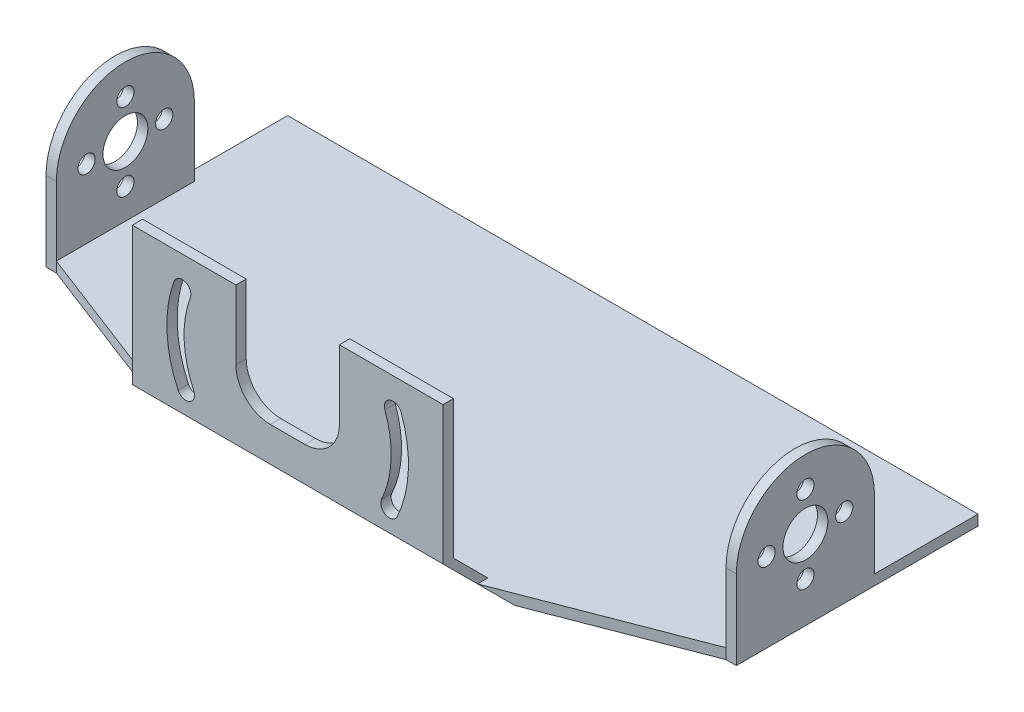
from build123d import *

# Parameters (mm, degrees)
SKETCH1_W                = 200
SKETCH1_H                = 100
BOSS_EXTRUDE1_DEPTH      = 3
BOSS_EXTRUDE2_DEPTH      = 50
CUT_EXTRUDE1_DEPTH       = 50
CUT_EXTRUDE2_DEPTH       = 152.026487743
CUT_EXTRUDE2_DEPTH_BACK  = 152.026487743
BOSS_EXTRUDE4_DEPTH      = 30
SKETCH7_R                = 6.5
CUT_EXTRUDE4_DEPTH       = 220
SKETCH8_W                = 3
SKETCH8_H                = 40
BOSS_EXTRUDE5_DEPTH      = 10
SKETCH9_R                = 2.5
CUT_EXTRUDE5_DEPTH       = 247
CUT_EXTRUDE6_DEPTH       = 29
CUT_EXTRUDE7_DEPTH       = 29
SKETCH12_W               = 90
SKETCH12_H               = 10
CUT_EXTRUDE9_DEPTH       = 3
BOSS_EXTRUDE6_DEPTH      = 90
CUT_EXTRUDE10_DEPTH      = 90
CUT_EXTRUDE11_DEPTH      = 90
CUT_EXTRUDE12_DEPTH      = 217.5
CUT_EXTRUDE14_DEPTH      = 59
CUT_EXTRUDE14_DEPTH_BACK = 122


with BuildPart() as part:
    # Sketch1 → Boss-Extrude1 (new body)
    with BuildSketch(Plane(origin=(0, 0, 0), x_dir=(1, 0, 0), z_dir=(0, 1, 0))):
        Rectangle(SKETCH1_W, SKETCH1_H)
    extrude(amount=BOSS_EXTRUDE1_DEPTH)

    # Sketch2 → Boss-Extrude2 (add)
    with BuildSketch(Plane(origin=(0, 3, 0), x_dir=(1, 0, 0), z_dir=(0, 1, 0))):
        Polygon((0, -50), (-45, -50), (-45, -47), (45, -47), (45, -50), align=None)
    extrude(amount=BOSS_EXTRUDE2_DEPTH)

    # Sketch3 → Cut-Extrude1 (cut)
    with BuildSketch(Plane.XY.offset(50)):
        with BuildLine():
            ThreePointArc((-32.889241728, 44.970705016), (-34.967685824, 31.496355047), (-31.740232125, 18.250163911))
            ThreePointArc((-31.740232125, 18.250163911), (-28.419512967, 17.036564194), (-27.20591325, 20.357283352))
            ThreePointArc((-27.20591325, 20.357283352), (-29.972302134, 31.711161468), (-28.190778624, 43.2606043))
            ThreePointArc((-28.190778624, 43.2606043), (-29.684959817, 46.46488621), (-32.889241728, 44.970705016))
        make_face()
        with BuildLine():
            ThreePointArc((27.20591325, 20.357283352), (28.419512967, 17.036564194), (31.740232125, 18.250163911))
            ThreePointArc((31.740232125, 18.250163911), (34.967685824, 31.496355047), (32.889241728, 44.970705016))
            ThreePointArc((32.889241728, 44.970705016), (29.684959817, 46.46488621), (28.190778624, 43.2606043))
            ThreePointArc((28.190778624, 43.2606043), (29.972302134, 31.711161468), (27.20591325, 20.357283352))
        make_face()
    extrude(amount=-CUT_EXTRUDE1_DEPTH, mode=Mode.SUBTRACT)

    # Sketch4 → Cut-Extrude2 (cut, two sides: drawn at the far end of the back side and taken through both)
    with BuildSketch(Plane.XY.offset(50).offset(-CUT_EXTRUDE2_DEPTH_BACK)):
        with BuildLine():
            Line((15, 33), (15, 53))
            Line((15, 53), (-15, 53))
            Line((-15, 53), (-15, 33))
            ThreePointArc((-15, 33), (-12.071067812, 25.928932188), (-5, 23))
            Line((-5, 23), (5, 23))
            ThreePointArc((5, 23), (12.071067812, 25.928932188), (15, 33))
        make_face()
    extrude(amount=CUT_EXTRUDE2_DEPTH + CUT_EXTRUDE2_DEPTH_BACK, mode=Mode.SUBTRACT)

    # Sketch5 → Boss-Extrude4 (add)
    with BuildSketch(Plane(origin=(0, 3, 0), x_dir=(1, 0, 0), z_dir=(0, 1, 0))):
        Polygon((-100, 0), (-100, 20), (-97, 20), (-97, -20), (-100, -20), align=None)
        Polygon((100, 0), (100, 20), (97, 20), (97, -20), (100, -20), align=None)
    extrude(amount=BOSS_EXTRUDE4_DEPTH)

    # Sketch7 → Cut-Extrude4 (cut)
    with BuildSketch(Plane.ZY.offset(100)):
        with Locations((0, 23)):
            Circle(SKETCH7_R)
    extrude(amount=-CUT_EXTRUDE4_DEPTH, mode=Mode.SUBTRACT)

    # Sketch8 → Boss-Extrude5 (add)
    with BuildSketch(Plane(origin=(0, 33, 0), x_dir=(1, 0, 0), z_dir=(0, 1, 0))):
        with Locations((-98.5, 0)):
            Rectangle(SKETCH8_W, SKETCH8_H)
        with Locations((98.5, 0)):
            Rectangle(SKETCH8_W, SKETCH8_H)
    extrude(amount=BOSS_EXTRUDE5_DEPTH)

    # Sketch9 → Cut-Extrude5 (cut)
    with BuildSketch(Plane.ZY.offset(100)):
        with Locations((0, 34.25)):
            Circle(SKETCH9_R)
        with Locations((-11.25, 23)):
            Circle(SKETCH9_R)
        with Locations((0, 11.75)):
            Circle(SKETCH9_R)
        with Locations((11.25, 23)):
            Circle(SKETCH9_R)
    extrude(amount=-CUT_EXTRUDE5_DEPTH, mode=Mode.SUBTRACT)

    # Sketch10 → Cut-Extrude6 (cut)
    with BuildSketch(Plane(origin=(0, 3, 0), x_dir=(1, 0, 0), z_dir=(0, 1, 0))):
        Polygon((-45, -50), (-100, -20), (-100, -50), align=None)
    extrude(amount=-CUT_EXTRUDE6_DEPTH, mode=Mode.SUBTRACT)

    # Sketch11 → Cut-Extrude7 (cut)
    with BuildSketch(Plane(origin=(0, 3, 0), x_dir=(1, 0, 0), z_dir=(0, 1, 0))):
        Polygon((45, -50), (100, -20), (100, -50), align=None)
    extrude(amount=-CUT_EXTRUDE7_DEPTH, mode=Mode.SUBTRACT)

    # Sketch12 → Cut-Extrude9 (cut)
    with BuildSketch(Plane.XY.offset(50)):
        with Locations((0, 8)):
            Rectangle(SKETCH12_W, SKETCH12_H)
    extrude(amount=-CUT_EXTRUDE9_DEPTH, mode=Mode.SUBTRACT)


with BuildPart() as cut_extrude9_piece_1:
    # of the separate pieces the step leaves, piece 1, a body of its own (cut_extrude9_pieces)
    add(part.part.solids().sort_by_distance((100, 0, -50))[0])



with BuildPart() as cut_extrude9_piece_2:
    # of the separate pieces the step leaves, piece 2, a body of its own (cut_extrude9_pieces)
    add(part.part.solids().sort_by_distance((-45, 13, 47))[0])


with BuildPart() as cut_extrude9_piece_1_1:
    add(cut_extrude9_piece_1.part)

    add(cut_extrude9_piece_2.part)  # Boss-Extrude6 merges Cut-Extrude9 piece 2
    # Sketch13 → Boss-Extrude6 (add)
    with BuildSketch(Plane.ZY.offset(45)):
        Polygon((47, 13), (37, 3), (47, 3), (50, 3), (50, 13), align=None)
    extrude(amount=-BOSS_EXTRUDE6_DEPTH)

    # Sketch14 → Cut-Extrude10 (cut)
    with BuildSketch(Plane.ZY.offset(45)):
        Polygon((50, 13), (40, 3), (50, 3), align=None)
    extrude(amount=-CUT_EXTRUDE10_DEPTH, mode=Mode.SUBTRACT)

    # Sketch15 → Cut-Extrude11 (cut)
    with BuildSketch(Plane(origin=(0, 3, 0), x_dir=(1, 0, 0), z_dir=(0, 1, 0))):
        Polygon((-100, -20), (-97, -20), (-45, -40), (45, -40), (97, -20), (100, -20), (45, -50), (-45, -50), align=None)
    extrude(amount=-CUT_EXTRUDE11_DEPTH, mode=Mode.SUBTRACT)

    # Sketch16 → Cut-Extrude12 (cut)
    with BuildSketch(Plane.ZY.offset(100)):
        with BuildLine():
            Line((-3.2e-08, 43), (-20, 43))
            Line((-20, 43), (-20, 23))
            ThreePointArc((-20, 23), (-14.142135635, 37.142135612), (-3.2e-08, 43))
        make_face()
        with BuildLine():
            Line((20, 43), (-3.2e-08, 43))
            ThreePointArc((-3.2e-08, 43), (14.142135612, 37.142135635), (20, 23))
            Line((20, 23), (20, 43))
        make_face()
    extrude(amount=-CUT_EXTRUDE12_DEPTH, mode=Mode.SUBTRACT)

    # Sketch17 → Cut-Extrude14 (cut, two sides: drawn at the far end of the back side and taken through both)
    with BuildSketch(Plane.ZY.offset(45).offset(-CUT_EXTRUDE14_DEPTH_BACK)):
        Polygon((40, 3), (40, 0), (37, 0), align=None)
    extrude(amount=CUT_EXTRUDE14_DEPTH + CUT_EXTRUDE14_DEPTH_BACK, mode=Mode.SUBTRACT)


solid = cut_extrude9_piece_1_1.part
